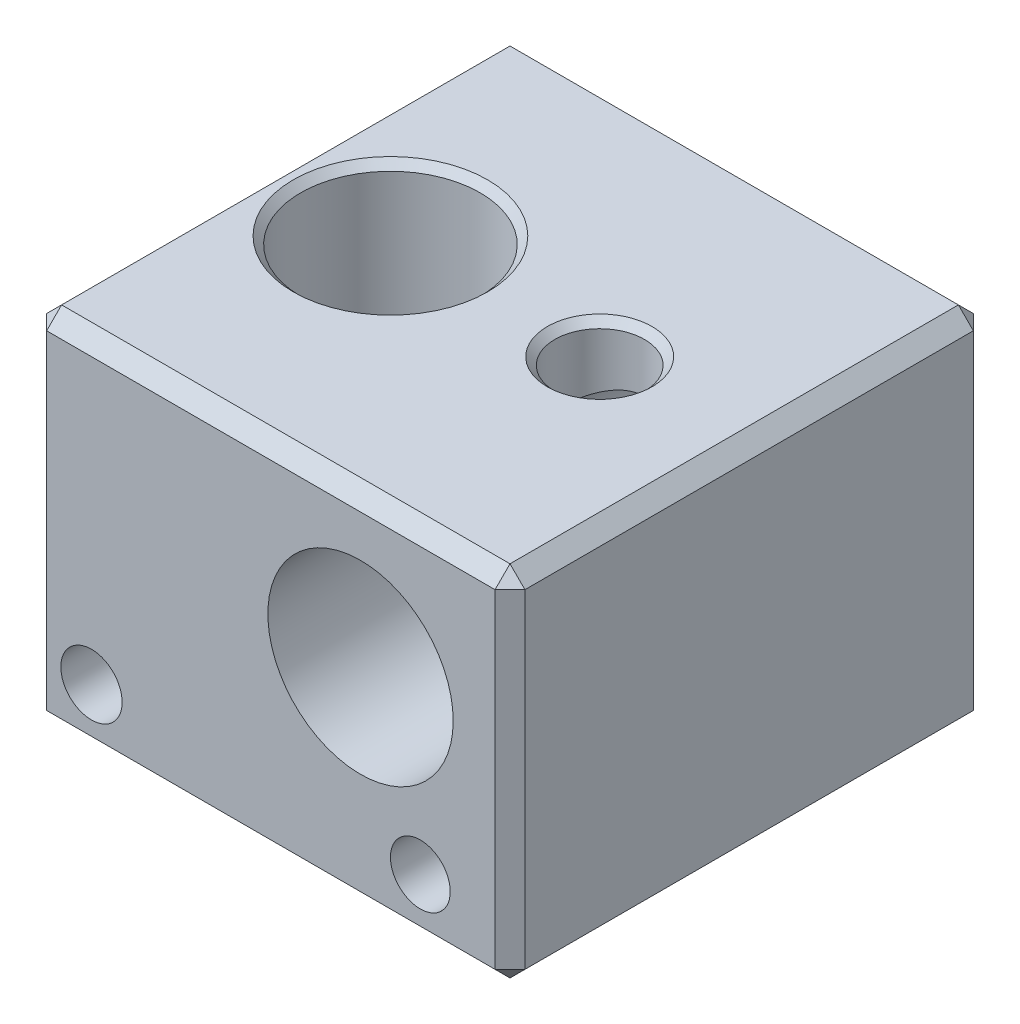
from build123d import *

# Parameters (mm, degrees)
SKETCH1_W                          = 16
SKETCH1_H                          = 16
SKETCH1_R                          = 3
BOSS_EXTRUDE1_DEPTH                = 6
TAP_DRILL_FOR_M2_5X0_45_TAP1_D     = 2.05
TAP_DRILL_FOR_M2_5X0_45_TAP1_DEPTH = 4.5
TAP_DRILL_FOR_M2_5X0_45_TAP1_TIP   = 0.615882135
SKETCH5_R                          = 3.1
SKETCH5_R_2                        = 1
CUT_EXTRUDE1_DEPTH                 = 19.867962264
SKETCH6_R                          = 1.5
CUT_EXTRUDE2_DEPTH                 = 6
CHAMFER1_SIZE                      = 0.5
CHAMFER2_SIZE                      = 0.25


with BuildPart() as part:
    # Sketch1 → Boss-Extrude1 (new, symmetric)
    with BuildSketch(Plane(origin=(0, 0, 0), x_dir=(1, 0, 0), z_dir=(0, 1, 0))):
        Rectangle(SKETCH1_W, SKETCH1_H)
        with Locations(Location((-4, 0, 0), (0, 0, 270))):
            Circle(SKETCH1_R, mode=Mode.SUBTRACT)
    extrude(amount=BOSS_EXTRUDE1_DEPTH, both=True)

    # Tap Drill for M2.5x0.45 Tap1
    with Locations(Plane.XY.offset(8)):
        with Locations((-6, -4)):
            Hole(TAP_DRILL_FOR_M2_5X0_45_TAP1_D / 2, depth=TAP_DRILL_FOR_M2_5X0_45_TAP1_DEPTH)
            with Locations((0, 0, -(TAP_DRILL_FOR_M2_5X0_45_TAP1_DEPTH + TAP_DRILL_FOR_M2_5X0_45_TAP1_TIP / 2))):  # 118° drill point
                Cone(0, TAP_DRILL_FOR_M2_5X0_45_TAP1_D / 2, TAP_DRILL_FOR_M2_5X0_45_TAP1_TIP, mode=Mode.SUBTRACT)

    # Sketch5 → Cut-Extrude1 (cut, through all)
    with BuildSketch(Plane.XY.offset(8)):
        with Locations((3, 1)):
            Circle(SKETCH5_R)
        with Locations((5, -4)):
            Circle(SKETCH5_R_2)
    extrude(amount=-CUT_EXTRUDE1_DEPTH, mode=Mode.SUBTRACT)

    # Sketch6 → Cut-Extrude2 (cut)
    with BuildSketch(Plane(origin=(0, 6, 0), x_dir=(1, 0, 0), z_dir=(0, 1, 0))):
        with Locations(Location((3, 0, 0), (0, 0, 270))):
            Circle(SKETCH6_R)
    extrude(amount=-CUT_EXTRUDE2_DEPTH, mode=Mode.SUBTRACT)

    # Chamfer1
    chamfer1_edges = [part.edges().sort_by_distance(p)[0] for p in [
        (8, 6, 0),
        (8, 0, 8),
        (-8, 0, 8),
        (-8, 0, -8),
        (8, 0, -8),
        (0, 6, -8),
        (-8, 6, 0),
        (0, 6, 8),
        (0, -6, 8),
        (-8, -6, 0),
        (0, -6, -8),
        (8, -6, 0),
    ]]
    chamfer(chamfer1_edges, length=CHAMFER1_SIZE)

    # Chamfer2
    chamfer2_edges = [part.edges().sort_by_distance(p)[0] for p in [
        (3, 6, -1.5),
        (-4, 6, -3),
        (-4, -6, -3),
    ]]
    chamfer(chamfer2_edges, length=CHAMFER2_SIZE)


solid = part.part
